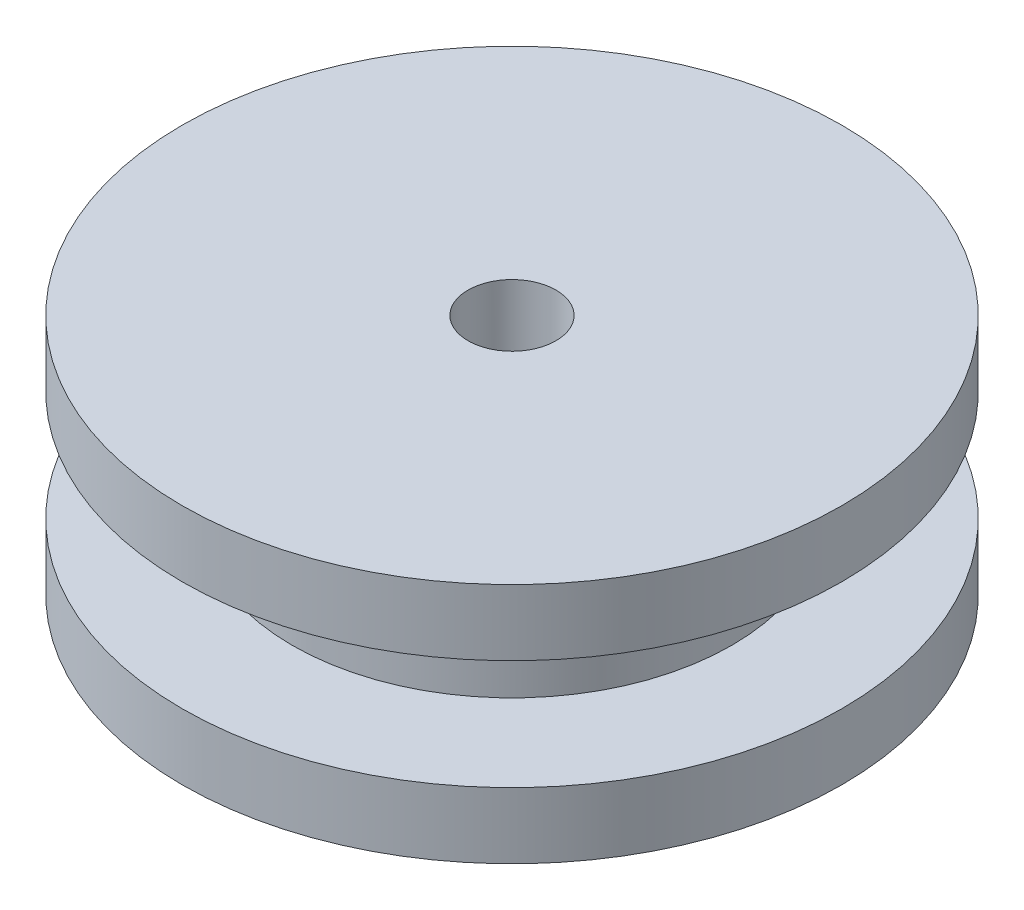
from build123d import *

# Parameters (mm, degrees)
SKETCH_1_R          = 15
EXTRUDE_1_DEPTH     = 3
SKETCH_2_R          = 10
EXTRUDE_2_DEPTH     = 5
SKETCH_3_R          = 15
EXTRUDE_3_DEPTH     = 3
SKETCH_5_R          = 2
CUT_EXTRUDE_1_DEPTH = 24.895606291


with BuildPart() as part:
    # ｽｹｯﾁ1 → ﾎﾞｽ - 押し出し1 (new body)
    with BuildSketch(Plane(origin=(0, 0, 0), x_dir=(1, 0, 0), z_dir=(0, 1, 0))):
        with Locations(Location((0, 0, 0), (0, 0, 270))):
            Circle(SKETCH_1_R)
    extrude(amount=EXTRUDE_1_DEPTH)

    # ｽｹｯﾁ2 → ﾎﾞｽ - 押し出し2 (add)
    with BuildSketch(Plane(origin=(0, 3, 0), x_dir=(1, 0, 0), z_dir=(0, 1, 0))):
        with Locations(Location((0, 0, 0), (0, 0, 270))):
            Circle(SKETCH_2_R)
    extrude(amount=EXTRUDE_2_DEPTH)


with BuildPart() as body_2:
    # ｽｹｯﾁ3 → ﾎﾞｽ - 押し出し3 (new body)
    with BuildSketch(Plane(origin=(0, 8, 0), x_dir=(1, 0, 0), z_dir=(0, 1, 0))):
        with Locations(Location((0, 0, 0), (0, 0, 270))):
            Circle(SKETCH_3_R)
    extrude(amount=EXTRUDE_3_DEPTH)


with BuildPart() as cut_extrude_1_tool:
    # ｽｹｯﾁ5 → ｶｯﾄ - 押し出し1 (new, through all)
    with BuildSketch(Plane.XZ):
        with Locations(Location((0, 0, 0), (0, 0, 270))):
            Circle(SKETCH_5_R)
    extrude(amount=-CUT_EXTRUDE_1_DEPTH)


with BuildPart() as part_1:
    add(part.part)

    # ｶｯﾄ - 押し出し1: cut by cut_extrude_1_tool
    add(cut_extrude_1_tool.part, mode=Mode.SUBTRACT)


with BuildPart() as body_2_1:
    add(body_2.part)

    # ｶｯﾄ - 押し出し1: cut by cut_extrude_1_tool
    add(cut_extrude_1_tool.part, mode=Mode.SUBTRACT)


solid = Compound([part_1.part, body_2_1.part])
